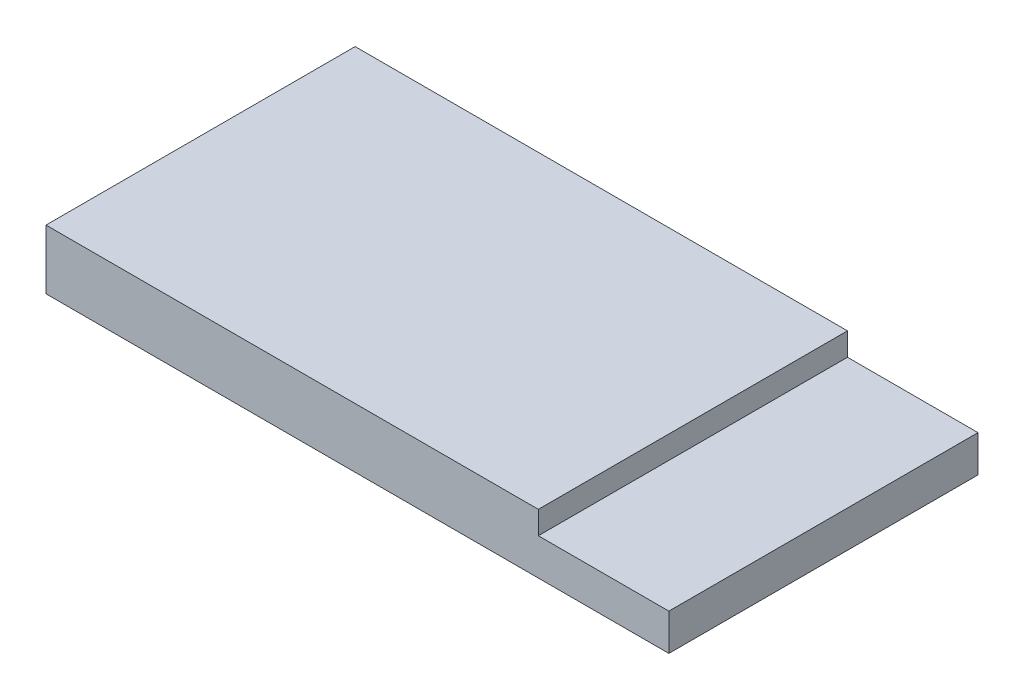
from build123d import *

# Parameters (mm, degrees)
SKETCH_1_W      = 27.2
SKETCH_1_H      = 13.5
EXTRUDE_1_DEPTH = 1.6
SKETCH_2_W      = 21.5
SKETCH_2_H      = 13.5
EXTRUDE_2_DEPTH = 1


with BuildPart() as part:
    # 草图1 → 拉伸1 (new body)
    with BuildSketch(Plane(origin=(0, 0, 0), x_dir=(1, 0, 0), z_dir=(0, 1, 0))):
        Rectangle(SKETCH_1_W, SKETCH_1_H)
    extrude(amount=EXTRUDE_1_DEPTH)

    # 草图2 → 拉伸2 (add)
    with BuildSketch(Plane(origin=(0, 1.6, 0), x_dir=(-1, 0, 0), z_dir=(0, 1, 0))):
        with Locations((2.85, 0)):
            Rectangle(SKETCH_2_W, SKETCH_2_H)
    extrude(amount=EXTRUDE_2_DEPTH)


solid = part.part
